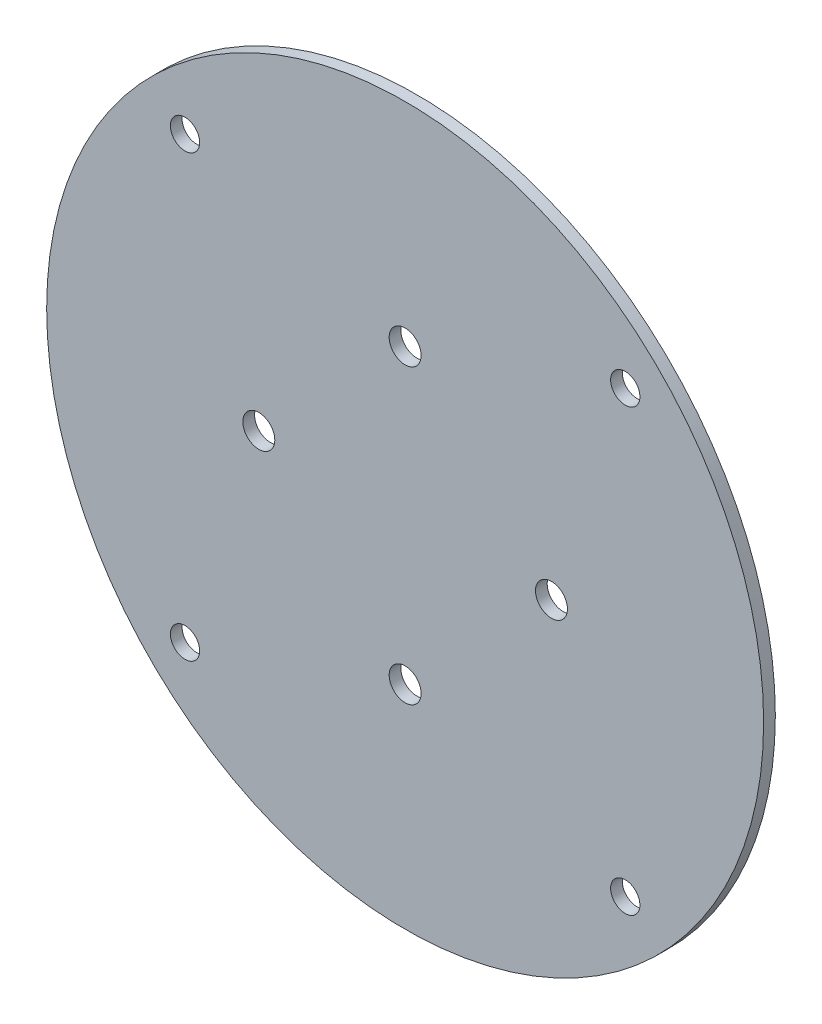
from build123d import *

# Parameters (mm, degrees)
SKETCH3_R                       = 49
BOSS_EXTRUDE1_DEPTH             = 1.6
F_4_0MM_CLEARANCE_DOWEL_HOLE1_D = 4
SKETCH7_R                       = 2.183129746
CUT_EXTRUDE1_DEPTH              = 70.314933456


with BuildPart() as part:
    # Sketch3 → Boss-Extrude1 (new body)
    with BuildSketch(Plane.XY):
        Circle(SKETCH3_R)
    extrude(amount=BOSS_EXTRUDE1_DEPTH)

    # Ø4.0mm Clearance Dowel Hole1 (through all)
    with Locations(Plane(origin=(0, 0, 0), x_dir=(1, 0, 0), z_dir=(0, 0, -1))):
        with Locations((-30.087393539, -30.08739354), (30.087393539, -30.08739354), (30.087393539, 30.087393539), (-30.08739354, 30.087393539)):
            Hole(F_4_0MM_CLEARANCE_DOWEL_HOLE1_D / 2)

    # Sketch7 → Cut-Extrude1 (cut, through all)
    with BuildSketch(Plane.XY):
        with Locations((0, 20)):
            Circle(SKETCH7_R)
        with Locations((20, 0)):
            Circle(SKETCH7_R)
        with Locations((0, -20)):
            Circle(SKETCH7_R)
        with Locations((-20, 0)):
            Circle(SKETCH7_R)
    extrude(amount=CUT_EXTRUDE1_DEPTH, mode=Mode.SUBTRACT)


solid = part.part
